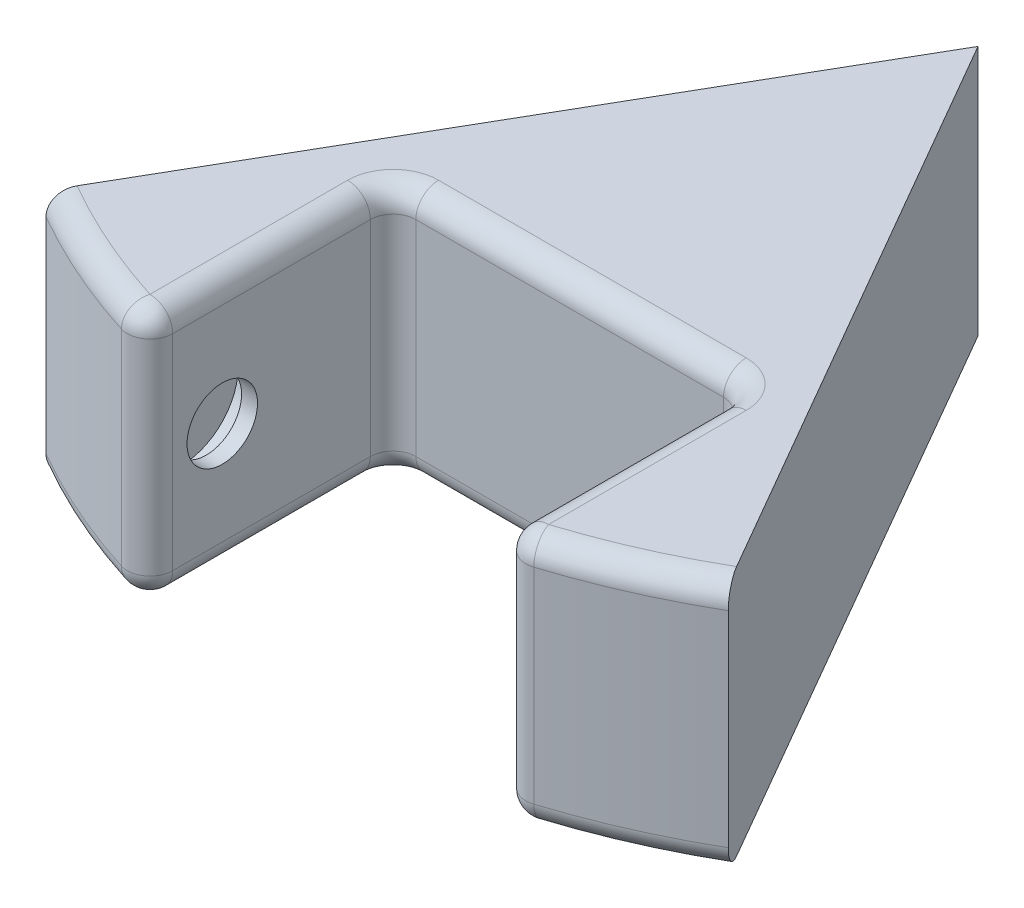
from build123d import *

# Parameters (mm, degrees)
BOSS_EXTRUDE1_DEPTH = 28
CUT_EXTRUDE1_DEPTH  = 90.677477663
SKETCH5_R           = 6.35
CUT_EXTRUDE2_DEPTH  = 4.572
SKETCH8_R           = 6.35
SKETCH8_R_2         = 3.937
BOSS_EXTRUDE4_DEPTH = 1.778
FILLET1_R           = 2.54


with BuildPart() as part:
    # Sketch2 → Boss-Extrude1 (new body)
    with BuildSketch(Plane(origin=(0, 0, 0), x_dir=(1, 0, 0), z_dir=(0, 1, 0))):
        with BuildLine():
            Line((-38.1, -65.991135768), (0, 0))
            Line((0, 0), (0, -76.2))
            ThreePointArc((0, -76.2), (-19.722011237, -73.603547963), (-38.1, -65.991135768))
        make_face()
    boss_extrude1 = extrude(amount=BOSS_EXTRUDE1_DEPTH)

    # Sketch4 → Cut-Extrude1 (cut, symmetric)
    with BuildSketch(Plane(origin=(0, 28, 0), x_dir=(1, 0, 0), z_dir=(0, 1, 0))):
        Polygon((-19.722011237, -73.603547963), (-19.722011237, -45.603553163), (19.722011237, -45.603553163), (19.722011237, -73.603547963), (19.722011237, -89.083413221), (-19.722011237, -89.083413221), align=None)
    cut_extrude1 = extrude(amount=CUT_EXTRUDE1_DEPTH, both=True, mode=Mode.SUBTRACT)

    # Sketch5 → Cut-Extrude2 (cut)
    with BuildSketch(Plane(origin=(-19.722011237, 0, 0), x_dir=(0, 0, -1), z_dir=(1, 0, 0))):
        with Locations((-64.683550563, 14)):
            Circle(SKETCH5_R)
    cut_extrude2 = extrude(amount=-CUT_EXTRUDE2_DEPTH, mode=Mode.SUBTRACT)

    # Sketch8 → Boss-Extrude4 (add)
    with BuildSketch(Plane(origin=(-19.722011237, 0, 0), x_dir=(0, 0, -1), z_dir=(1, 0, 0))):
        with Locations((-64.683550563, 14)):
            Circle(SKETCH8_R)
        with Locations((-64.683550563, 14)):
            Circle(SKETCH8_R_2, mode=Mode.SUBTRACT)
    boss_extrude4 = extrude(amount=-BOSS_EXTRUDE4_DEPTH)

    # Mirror1: Boss-Extrude1, Cut-Extrude1, Cut-Extrude2, Boss-Extrude4 across plane
    add(boss_extrude1.mirror(Plane(origin=(0, 28, 0), x_dir=(0, 0, 1), z_dir=(-1, 0, 0))))
    add(cut_extrude1.mirror(Plane(origin=(0, 28, 0), x_dir=(0, 0, 1), z_dir=(-1, 0, 0))), mode=Mode.SUBTRACT)
    add(cut_extrude2.mirror(Plane(origin=(0, 28, 0), x_dir=(0, 0, 1), z_dir=(-1, 0, 0))), mode=Mode.SUBTRACT)
    add(boss_extrude4.mirror(Plane(origin=(0, 28, 0), x_dir=(0, 0, 1), z_dir=(-1, 0, 0))))

    # Fillet1
    fillet1_edges = [part.edges().sort_by_distance(p)[0] for p in [
        (0, 0, 45.603553163),
        (-29.160477546, 28, 70.399620377),
        (-19.722011237, 0, 59.603550563),
        (-19.722011237, 14, 73.603547963),
        (-19.722011237, 28, 59.603550563),
        (0, 28, 45.603553163),
        (-19.722011237, 14, 45.603553163),
        (-29.160477546, 0, 70.399620377),
        (29.160477546, 28, 70.399620377),
        (29.160477546, 0, 70.399620377),
        (19.722011237, 0, 59.603550563),
        (19.722011237, 14, 73.603547963),
        (19.722011237, 28, 59.603550563),
        (19.722011237, 14, 45.603553163),
    ]]
    fillet(fillet1_edges, radius=FILLET1_R)


solid = part.part
